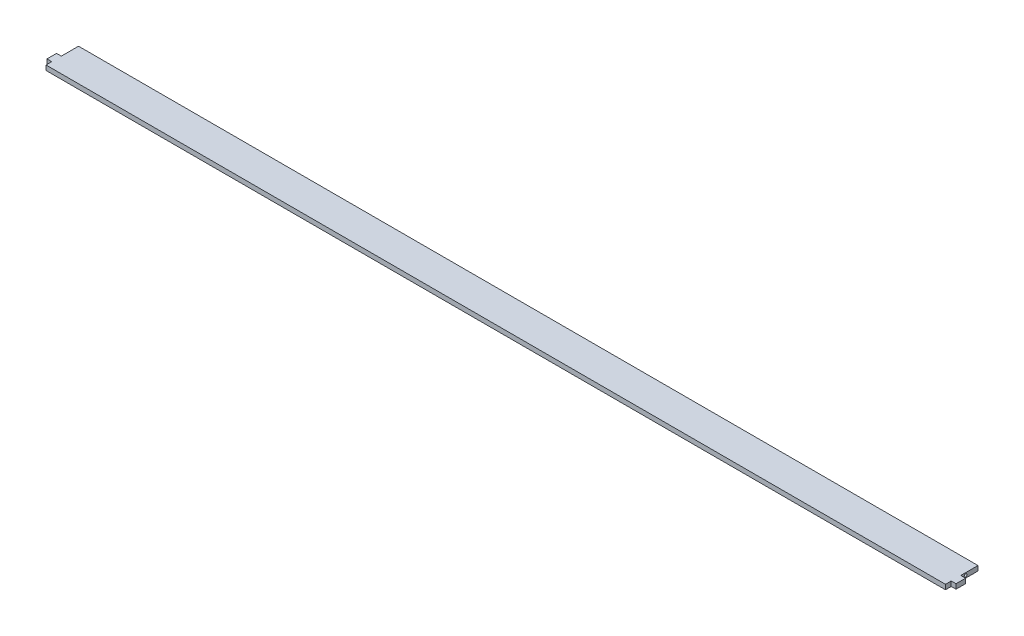
from build123d import *

# Parameters (mm, degrees)
BOSS_EXTRUDE1_DEPTH = 3.175
SKETCH2_R           = 0.889
CUT_EXTRUDE1_DEPTH  = 6.35


with BuildPart() as part:
    # Sketch1 → Boss-Extrude1 (new body)
    with BuildSketch(Plane(origin=(0, 0, 0), x_dir=(1, 0, 0), z_dir=(0, 1, 0))):
        Polygon((-298.45, -6.245695132), (-298.45, -10.055695132), (298.45, -10.055695132), (298.45, -6.245695132), (301.625, -6.245695132), (301.625, 0.104304868), (298.45, 0.104304868), (298.45, 11.534304868), (-298.45, 11.534304868), (-298.45, 0.104304868), (-301.625, 0.104304868), (-301.625, -6.245695132), align=None)
    extrude(amount=BOSS_EXTRUDE1_DEPTH)

    # Sketch2 → Cut-Extrude1 (cut)
    with BuildSketch(Plane.ZY.offset(298.45)):
        with Locations((-3.279304868, 1.5875)):
            Circle(SKETCH2_R)
    cut_extrude1 = extrude(amount=-CUT_EXTRUDE1_DEPTH, mode=Mode.SUBTRACT)

    # Mirror1: Cut-Extrude1 across plane
    add(cut_extrude1.mirror(Plane(origin=(0, 0, 0), x_dir=(0, 0, 1), z_dir=(1, 0, 0))), mode=Mode.SUBTRACT)


solid = part.part
